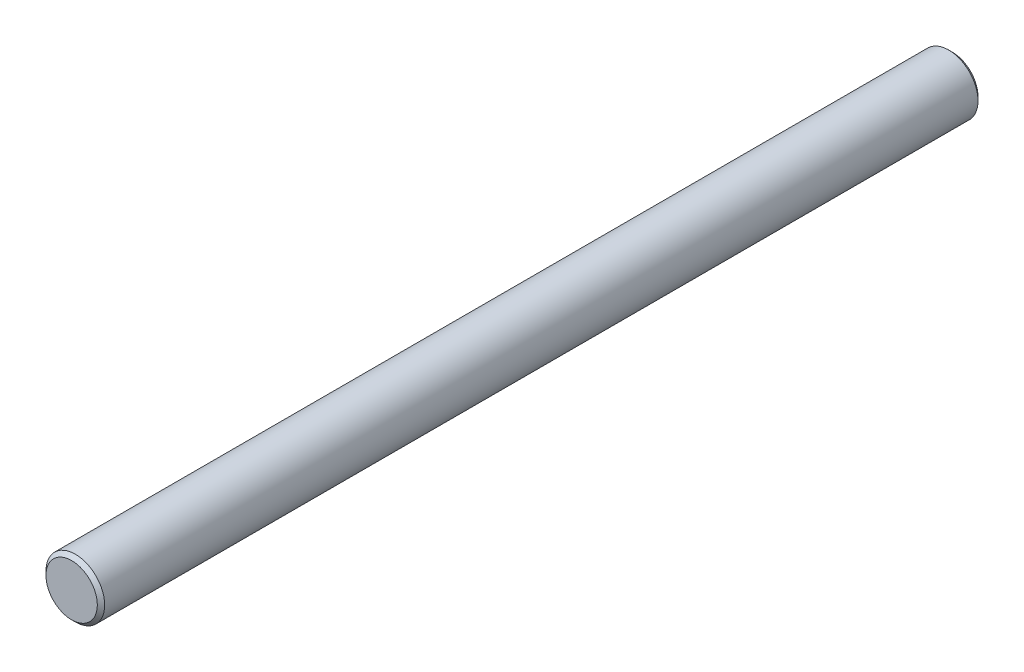
from build123d import *

# Parameters (mm, degrees)
SKIZZE1_R                       = 4
AUFSATZ_LINEAR_AUSTRAGEN1_DEPTH = 120
FASE1_SIZE                      = 0.5


with BuildPart() as part:
    # Skizze1 → Aufsatz-Linear austragen1 (new body)
    with BuildSketch(Plane.XY):
        Circle(SKIZZE1_R)
    extrude(amount=AUFSATZ_LINEAR_AUSTRAGEN1_DEPTH)

    # Fase1
    fase1_edges = [part.edges().sort_by_distance(p)[0] for p in [
        (-4, 0, 0),
        (-4, 0, 120),
    ]]
    chamfer(fase1_edges, length=FASE1_SIZE)


solid = part.part
